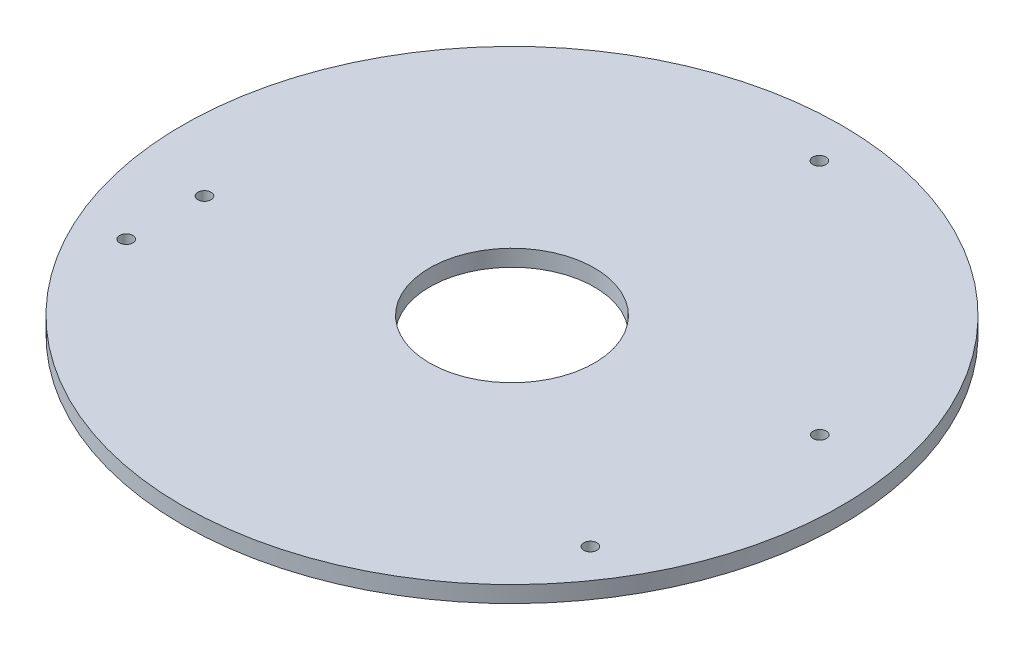
from build123d import *

# Parameters (mm, degrees)
SKETCH_1_R               = 80
SKETCH_1_R_2             = 1.6
EXTRUDE_1_DEPTH          = 4
CUT_EXTRUDE_1_DEPTH      = 114.207773585
CUT_EXTRUDE_1_DEPTH_BACK = 114.207773585
SKETCH_2_R               = 1.6
CUT_EXTRUDE_2_DEPTH      = 114.207773585
CUT_EXTRUDE_2_DEPTH_BACK = 114.207773585
SKETCH_3_R               = 20


with BuildPart() as part:
    # 草图1 → 凸台-拉伸1 (new body)
    with BuildSketch(Plane(origin=(0, 0, 0), x_dir=(1, 0, 0), z_dir=(0, 1, 0))):
        with Locations(Location((0, 0, 0), (0, 0, 270))):
            Circle(SKETCH_1_R)
        with Locations(Location((4.784441198, 69.836302325, 0), (0, 0, 270))):
            Circle(SKETCH_1_R_2, mode=Mode.SUBTRACT)
        with Locations(Location((-62.872232519, -30.774703542, 0), (0, 0, 270))):
            Circle(SKETCH_1_R_2, mode=Mode.SUBTRACT)
        with Locations(Location((58.087791321, -39.061598783, 0), (0, 0, 270))):
            Circle(SKETCH_1_R_2, mode=Mode.SUBTRACT)
    extrude(amount=EXTRUDE_1_DEPTH)

    # 草图2 → 切除-拉伸1 (cut, two sides: drawn at the far end of the back side and taken through both)
    with BuildSketch(Plane(origin=(0, 4, 0), x_dir=(1, 0, 0), z_dir=(0, 1, 0)).offset(-CUT_EXTRUDE_1_DEPTH_BACK)):
        with Locations(Location((-62.451230924, -12.202314724, 0), (0, 0, 270))):
            Circle(SKETCH_2_R)
        with Locations(Location((62.455127781, 12.259932826, 0), (0, 0, 270))):
            Circle(SKETCH_2_R)
    extrude(amount=CUT_EXTRUDE_1_DEPTH + CUT_EXTRUDE_1_DEPTH_BACK, mode=Mode.SUBTRACT)

    # 草图3 → 切除-拉伸2 (cut, two sides: drawn at the far end of the back side and taken through both)
    with BuildSketch(Plane(origin=(0, 4, 0), x_dir=(1, 0, 0), z_dir=(0, 1, 0)).offset(-CUT_EXTRUDE_2_DEPTH_BACK)):
        with Locations(Location((0, 0, 0), (0, 0, 270))):
            Circle(SKETCH_3_R)
    extrude(amount=CUT_EXTRUDE_2_DEPTH + CUT_EXTRUDE_2_DEPTH_BACK, mode=Mode.SUBTRACT)


solid = part.part
